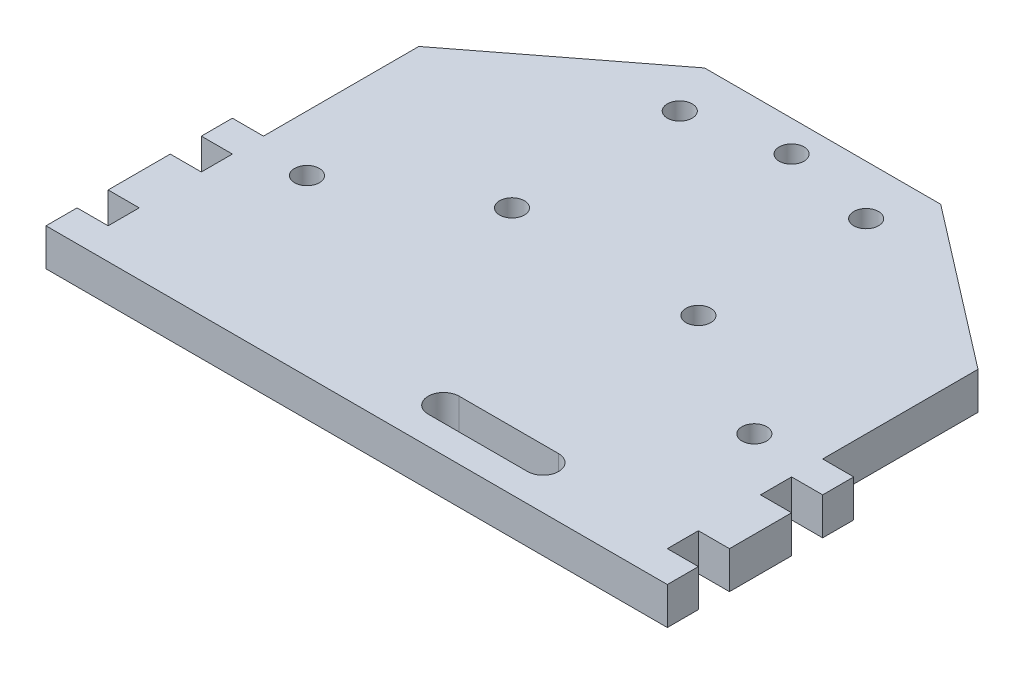
from build123d import *

# Parameters (mm, degrees)
SKETCH1_R           = 2
BOSS_EXTRUDE1_DEPTH = 6


with BuildPart() as part:
    # Sketch1 → Boss-Extrude1 (new body)
    with BuildSketch(Plane(origin=(0, 0, 0), x_dir=(1, 0, 0), z_dir=(0, 1, 0))):
        Polygon((-45, 15), (-45, -10), (-50, -10), (-50, -15), (-45, -15), (-45, -20), (-50, -20), (-50, -30), (-45, -30), (-45, -35), (-50, -35), (-50, -40), (-45, -40), (45, -40), (50, -40), (50, -35), (45, -35), (45, -33), (45, -30), (50, -30), (50, -20), (45, -20), (45, -15), (50, -15), (50, -10), (45, -10), (45, 15), (19, 35), (-19, 35), align=None)
        with Locations(Location((15, 0, 0), (0, 0, 270))):
            Circle(SKETCH1_R, mode=Mode.SUBTRACT)
        with Locations(Location((-15, 0, 0), (0, 0, 270))):
            Circle(SKETCH1_R, mode=Mode.SUBTRACT)
        with Locations(Location((15, 27, 0), (0, 0, 270))):
            Circle(SKETCH1_R, mode=Mode.SUBTRACT)
        with Locations(Location((-15, 27, 0), (0, 0, 270))):
            Circle(SKETCH1_R, mode=Mode.SUBTRACT)
        with Locations(Location((0, 30, 0), (0, 0, 270))):
            Circle(SKETCH1_R, mode=Mode.SUBTRACT)
        with Locations(Location((-36, -12, 0), (0, 0, 270))):
            Circle(SKETCH1_R, mode=Mode.SUBTRACT)
        with Locations(Location((36, -12, 0), (0, 0, 270))):
            Circle(SKETCH1_R, mode=Mode.SUBTRACT)
        with BuildLine():
            Line((7, -30.5), (23, -30.5))
            ThreePointArc((23, -30.5), (25.5, -33), (23, -35.5))
            Line((23, -35.5), (7, -35.5))
            ThreePointArc((7, -35.5), (4.5, -33), (7, -30.5))
        make_face(mode=Mode.SUBTRACT)
    extrude(amount=BOSS_EXTRUDE1_DEPTH)


solid = part.part
